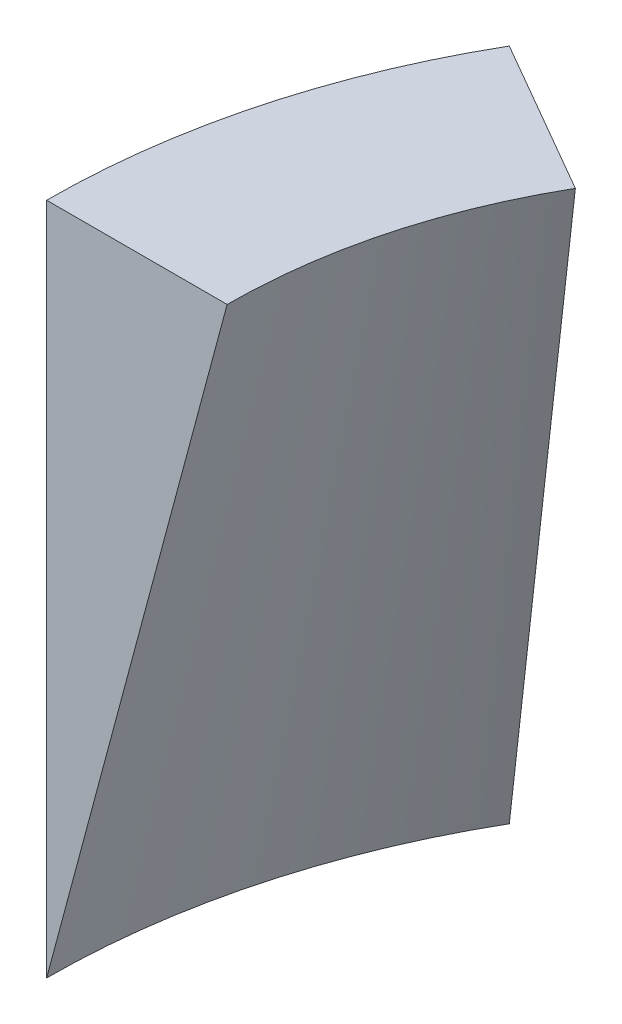
from build123d import *

# Parameters (mm, degrees)
REVOLVE1_ANGLE = 30


with BuildPart() as part:
    # Sketch1 → Revolve1 (revolve)
    with BuildSketch(Plane.XY):
        Polygon((0, 0), (1.889390108, 7.051299877), (0, 7.051299877), align=None)
    revolve(axis=Axis((7.639390108, 7.051299877, 0), (0, -1, 0)), revolution_arc=REVOLVE1_ANGLE)


solid = part.part
